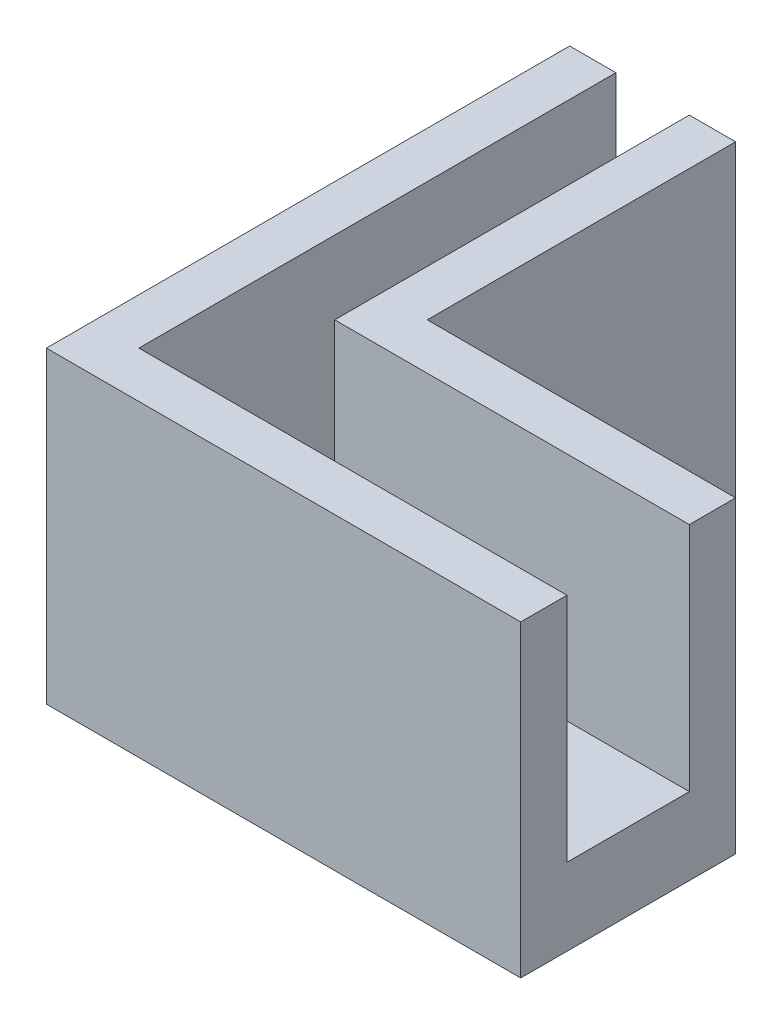
from build123d import *

# Parameters (mm, degrees)
BOSS_EXTRUDE7_DEPTH = 15
BOSS_EXTRUDE8_DEPTH = 5
SKETCH3_W           = 4.7625
SKETCH3_H           = 3
SKETCH3_W_2         = 3
SKETCH3_H_2         = 7.9375
CUT_EXTRUDE1_DEPTH  = 15


with BuildPart() as part:
    # Sketch1 → Boss-Extrude7 (new body)
    with BuildSketch(Plane(origin=(0, 0, 0), x_dir=(1, 0, 0), z_dir=(0, 1, 0))):
        Polygon((24.7625, 10.9375), (7.7625, 10.9375), (7.7625, 27.9375), (7.7625, 30.9375), (-3, 30.9375), (-3, 27.9375), (-3, -3), (24.7625, -3), (27.7625, -3), (27.7625, 10.9375), align=None)
        Polygon((0, 0), (4.7625, 0), (24.7625, 0), (24.7625, 7.9375), (4.7625, 7.9375), (4.7625, 27.9375), (0, 27.9375), align=None, mode=Mode.SUBTRACT)
    extrude(amount=BOSS_EXTRUDE7_DEPTH)

    # Sketch2 → Boss-Extrude8 (add)
    with BuildSketch(Plane.XZ):
        Polygon((27.7625, 3), (27.7625, -10.9375), (7.7625, -10.9375), (7.7625, -30.9375), (-3, -30.9375), (-3, 3), align=None)
    extrude(amount=BOSS_EXTRUDE8_DEPTH)

    # Sketch3 → Cut-Extrude1 (cut)
    with BuildSketch(Plane(origin=(0, 15, 0), x_dir=(1, 0, 0), z_dir=(0, 1, 0))):
        with Locations((2.38125, 29.4375)):
            Rectangle(SKETCH3_W, SKETCH3_H)
        with Locations((26.2625, 3.96875)):
            Rectangle(SKETCH3_W_2, SKETCH3_H_2)
    extrude(amount=-CUT_EXTRUDE1_DEPTH, mode=Mode.SUBTRACT)


solid = part.part
